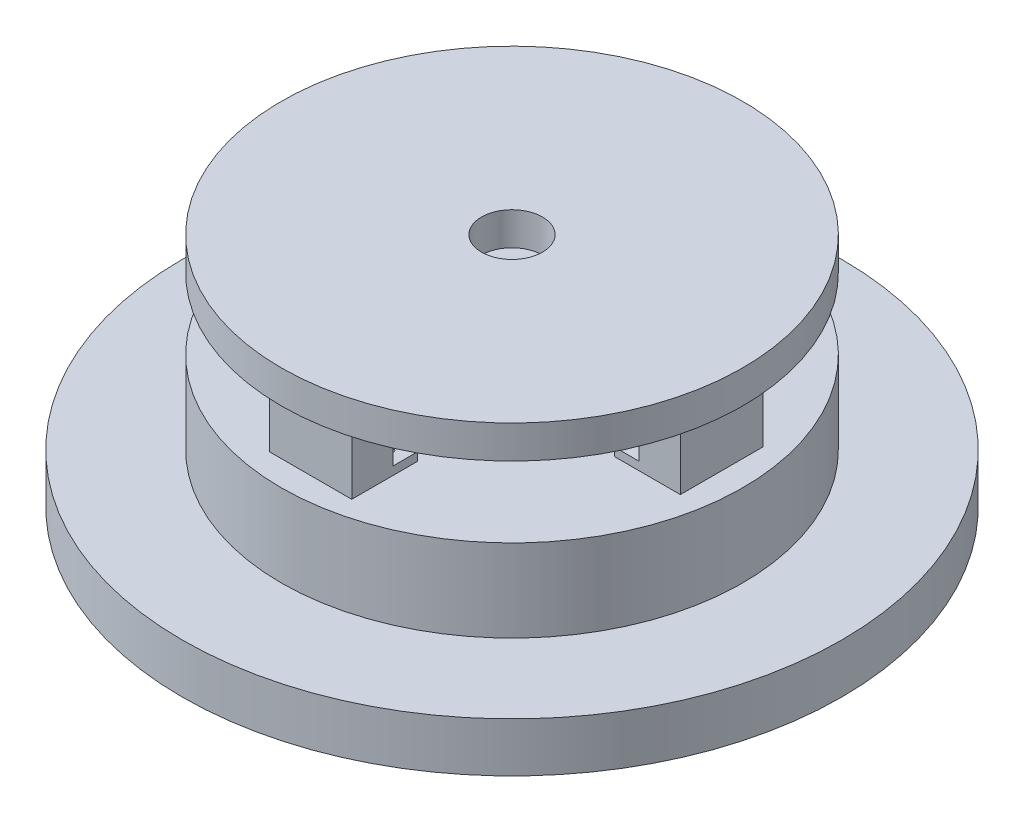
from build123d import *

# Parameters (mm, degrees)
SKETCH_1_R          = 200
EXTRUDE_1_DEPTH     = 30
SKETCH_2_R          = 140
EXTRUDE_2_DEPTH     = 50
SKETCH_4_R          = 1.75
CUT_EXTRUDE_1_DEPTH = 28
SKETCH_7_W          = 25
SKETCH_7_H          = 50
SKETCH_7_W_2        = 50
SKETCH_7_H_2        = 25
EXTRUDE_5_DEPTH     = 43
SKETCH_8_W          = 15
SKETCH_8_H          = 50
SKETCH_8_W_2        = 50
SKETCH_8_H_2        = 15
EXTRUDE_6_DEPTH     = 5
SKETCH_9_R          = 1.75
CUT_EXTRUDE_2_DEPTH = 20
SKETCH_10_R         = 140
EXTRUDE_7_DEPTH     = 20
SKETCH_11_R         = 2.5
CUT_EXTRUDE_3_DEPTH = 20
CUT_EXTRUDE_4_REACH = 318.937
SKETCH_13_R         = 18.5


with BuildPart() as part:
    # 草图1 → 凸台-拉伸1 (new body)
    with BuildSketch(Plane(origin=(0, 0, 0), x_dir=(1, 0, 0), z_dir=(0, 1, 0))):
        with Locations(Location((0, 0, 0), (0, 0, 270))):
            Circle(SKETCH_1_R)
    extrude(amount=EXTRUDE_1_DEPTH)

    # 草图2 → 凸台-拉伸2 (add)
    with BuildSketch(Plane(origin=(0, 30, 0), x_dir=(1, 0, 0), z_dir=(0, 1, 0))):
        with Locations(Location((0, 0, 0), (0, 0, 270))):
            Circle(SKETCH_2_R)
    extrude(amount=EXTRUDE_2_DEPTH)

    # 草图4 → 切除-拉伸1 (cut)
    with BuildSketch(Plane(origin=(0, 80, 0), x_dir=(1, 0, 0), z_dir=(0, 1, 0))):
        with Locations(Location((0, -42.5, 0), (0, 0, 270))):
            Circle(SKETCH_4_R)
        with Locations(Location((-30.0520382, -30.0520382, 0), (0, 0, 270))):
            Circle(SKETCH_4_R)
        with Locations(Location((-42.5, 0, 0), (0, 0, 270))):
            Circle(SKETCH_4_R)
        with Locations(Location((-30.0520382, 30.0520382, 0), (0, 0, 270))):
            Circle(SKETCH_4_R)
        with Locations(Location((0, 42.5, 0), (0, 0, 270))):
            Circle(SKETCH_4_R)
        with Locations(Location((30.0520382, 30.0520382, 0), (0, 0, 270))):
            Circle(SKETCH_4_R)
        with Locations(Location((42.5, 0, 0), (0, 0, 270))):
            Circle(SKETCH_4_R)
        with Locations(Location((30.0520382, -30.0520382, 0), (0, 0, 270))):
            Circle(SKETCH_4_R)
    extrude(amount=-CUT_EXTRUDE_1_DEPTH, mode=Mode.SUBTRACT)

    # 草图7 → 凸台-拉伸5 (add)
    with BuildSketch(Plane(origin=(0, 80, 0), x_dir=(1, 0, 0), z_dir=(0, 1, 0))):
        with Locations((-112.162325809, -2.462481049)):
            Rectangle(SKETCH_7_W, SKETCH_7_H)
        with Locations((2.462481049, -112.162325809)):
            Rectangle(SKETCH_7_W_2, SKETCH_7_H_2)
        with Locations((-2.462481049, 112.162325809)):
            Rectangle(SKETCH_7_W_2, SKETCH_7_H_2)
        with Locations((112.162325809, 2.462481049)):
            Rectangle(SKETCH_7_W, SKETCH_7_H)
    extrude(amount=EXTRUDE_5_DEPTH)

    # 草图8 → 凸台-拉伸6 (add)
    with BuildSketch(Plane(origin=(0, 80, 0), x_dir=(1, 0, 0), z_dir=(0, 1, 0))):
        with Locations((92.162325809, 2.462481049)):
            Rectangle(SKETCH_8_W, SKETCH_8_H)
        with Locations((-2.462481049, 92.162325809)):
            Rectangle(SKETCH_8_W_2, SKETCH_8_H_2)
        with Locations((2.462481049, -92.162325809)):
            Rectangle(SKETCH_8_W_2, SKETCH_8_H_2)
        with Locations((-92.162325809, -2.462481049)):
            Rectangle(SKETCH_8_W, SKETCH_8_H)
    extrude(amount=EXTRUDE_6_DEPTH)

    # 草图9 → 切除-拉伸2 (cut)
    with BuildSketch(Plane(origin=(0, 85, 0), x_dir=(1, 0, 0), z_dir=(0, 1, 0))):
        with Locations(Location((18.656155403, -92.162325809, 0), (0, 0, 270))):
            Circle(SKETCH_9_R)
        with Locations(Location((-11.970984699, -92.162325809, 0), (0, 0, 270))):
            Circle(SKETCH_9_R)
        with Locations(Location((-92.162325809, 11.970984699, 0), (0, 0, 270))):
            Circle(SKETCH_9_R)
        with Locations(Location((-92.162325809, -18.656155403, 0), (0, 0, 270))):
            Circle(SKETCH_9_R)
        with Locations(Location((11.970984699, 92.162325809, 0), (0, 0, 270))):
            Circle(SKETCH_9_R)
        with Locations(Location((-18.656155403, 92.162325809, 0), (0, 0, 270))):
            Circle(SKETCH_9_R)
        with Locations(Location((92.162325809, -11.970984699, 0), (0, 0, 270))):
            Circle(SKETCH_9_R)
        with Locations(Location((92.162325809, 18.656155403, 0), (0, 0, 270))):
            Circle(SKETCH_9_R)
    extrude(amount=-CUT_EXTRUDE_2_DEPTH, mode=Mode.SUBTRACT)

    # 草图10 → 凸台-拉伸7 (add)
    with BuildSketch(Plane(origin=(0, 123, 0), x_dir=(1, 0, 0), z_dir=(0, 1, 0))):
        with Locations(Location((0, 0, 0), (0, 0, 270))):
            Circle(SKETCH_10_R)
    extrude(amount=EXTRUDE_7_DEPTH)

    # 草图11 → 切除-拉伸3 (cut)
    with BuildSketch(Plane(origin=(0, 143, 0), x_dir=(1, 0, 0), z_dir=(0, 1, 0))):
        with Locations(Location((0, 0, 0), (0, 0, 270))):
            Circle(SKETCH_11_R)
    extrude(amount=-CUT_EXTRUDE_3_DEPTH, mode=Mode.SUBTRACT)

    # 草图13 → 切除-拉伸4 (cut, up to next)
    with BuildSketch(Plane(origin=(0, 143, 0), x_dir=(1, 0, 0), z_dir=(0, 1, 0)), mode=Mode.PRIVATE) as cut_extrude_4_sk1:
        with Locations(Location((0, 0, 0), (0, 0, 270))):
            Circle(SKETCH_13_R)
    cut_extrude_4_tool1 = extrude(cut_extrude_4_sk1.sketch, amount=-CUT_EXTRUDE_4_REACH, mode=Mode.PRIVATE) & part.part
    add(cut_extrude_4_tool1.solids().sort_by_distance((0, 143, 0))[0], mode=Mode.SUBTRACT)


solid = part.part
